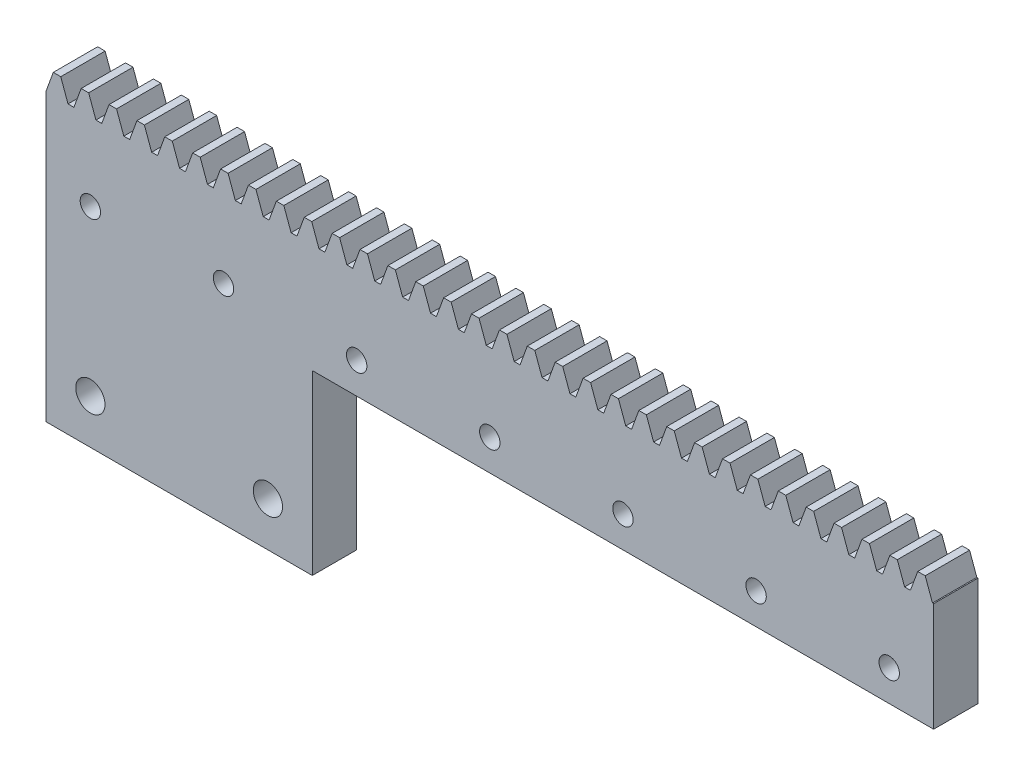
from build123d import *

# Parameters (mm, degrees)
SKETCH1_W           = 106.814150222
SKETCH1_H           = 8
EXTRUDE1_DEPTH      = 5
EXTRUDE2_DEPTH      = 5
LPATTERN1_COUNT     = 34
LPATTERN1_PITCH     = 3.141592654
SKETCH_2_W          = 106.814150222
SKETCH_2_H          = 5
EXTRUDE_1_DEPTH     = 4.25
SKETCH_3_W          = 5
SKETCH_3_H          = 17.759873191
CUT_EXTRUDE_1_DEPTH = 6.814150222
SKETCH_4_R          = 1.15
CUT_EXTRUDE_2_DEPTH = 101.87151481
SKETCH_5_W          = 30
SKETCH_5_H          = 20
EXTRUDE_2_DEPTH     = 5
SKETCH_6_R          = 1.65
CUT_EXTRUDE_3_DEPTH = 13


with BuildPart() as part:
    # Sketch1 → Extrude1 (new body)
    with BuildSketch(Plane.XY):
        with Locations((53.407075111, -4)):
            Rectangle(SKETCH1_W, SKETCH1_H)
    extrude(amount=EXTRUDE1_DEPTH)

    # Sketch2 → Extrude2 (add)
    with BuildSketch(Plane.XY.offset(5)):
        Polygon((0, 0), (0.818933027, 2.25), (1.661788885, 2.25), (2.480721912, 0), align=None)
    extrude2 = extrude(amount=-EXTRUDE2_DEPTH)

    # LPattern1: Extrude2 ×34
    with Locations(*[(i * LPATTERN1_PITCH, 0, 0) for i in range(1, LPATTERN1_COUNT)]):
        add(extrude2)

    # 草图2 → 凸台-拉伸1 (add)
    with BuildSketch(Plane.XZ.offset(8)):
        with Locations((53.407075111, 2.5)):
            Rectangle(SKETCH_2_W, SKETCH_2_H)
    extrude(amount=EXTRUDE_1_DEPTH)

    # 草图3 → 切除-拉伸1 (cut)
    with BuildSketch(Plane(origin=(106.814150222, 0, 0), x_dir=(0, 0, -1), z_dir=(1, 0, 0))):
        with Locations((-2.5, -3.370063404)):
            Rectangle(SKETCH_3_W, SKETCH_3_H)
    extrude(amount=-CUT_EXTRUDE_1_DEPTH, mode=Mode.SUBTRACT)

    # 草图4 → 切除-拉伸2 (cut, through all)
    with BuildSketch(Plane.XY.offset(5)):
        with Locations((5, -8.75)):
            Circle(SKETCH_4_R)
        with Locations((20, -8.75)):
            Circle(SKETCH_4_R)
        with Locations((35, -8.75)):
            Circle(SKETCH_4_R)
        with Locations((50, -8.75)):
            Circle(SKETCH_4_R)
        with Locations((65, -8.75)):
            Circle(SKETCH_4_R)
        with Locations((80, -8.75)):
            Circle(SKETCH_4_R)
        with Locations((95, -8.75)):
            Circle(SKETCH_4_R)
    extrude(amount=-CUT_EXTRUDE_2_DEPTH, mode=Mode.SUBTRACT)

    # 草图5 → 凸台-拉伸2 (add)
    with BuildSketch(Plane.XY.offset(5)):
        with Locations((15, -22.25)):
            Rectangle(SKETCH_5_W, SKETCH_5_H)
    extrude(amount=-EXTRUDE_2_DEPTH)

    # 草图6 → 切除-拉伸3 (cut)
    with BuildSketch(Plane.XY.offset(5)):
        with Locations((25, -27.25)):
            Circle(SKETCH_6_R)
        with Locations((5, -27.25)):
            Circle(SKETCH_6_R)
    extrude(amount=-CUT_EXTRUDE_3_DEPTH, mode=Mode.SUBTRACT)


solid = part.part
